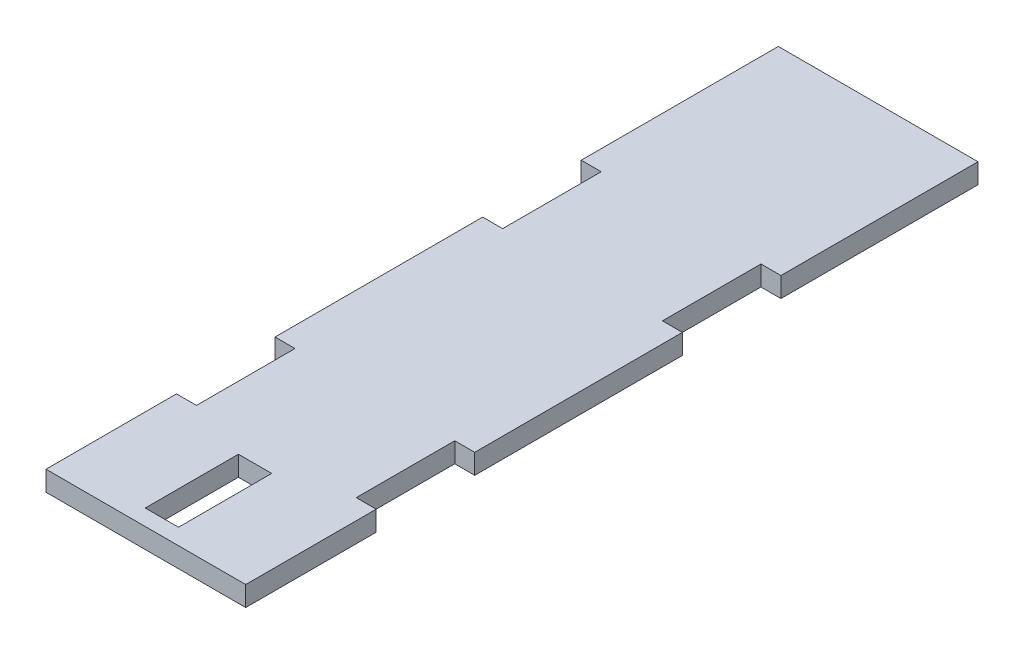
from build123d import *

# Parameters (mm, degrees)
EXTRUDE_1_DEPTH     = 3
SKETCH_2_W          = 30
SKETCH_2_H          = 3
EXTRUDE_2_DEPTH     = 10
SKETCH_4_W          = 5
SKETCH_4_H          = 14
CUT_EXTRUDE_1_DEPTH = 10


with BuildPart() as part:
    # Эскиз1 → Бобышка-Вытянуть1 (new body)
    with BuildSketch(Plane(origin=(0, 0, 0), x_dir=(1, 0, 0), z_dir=(0, 1, 0))):
        Polygon((-15, -50), (15, -50), (15, -30.397249725), (12, -30.397249725), (12, -15.597249725), (15, -15.597249725), (15, 15.597249725), (12, 15.597249725), (12, 30.397249725), (15, 30.397249725), (15, 50), (-15, 50), (-15, 30.397249725), (-12, 30.397249725), (-12, 15.597249725), (-15, 15.597249725), (-15, -15.597249725), (-12, -15.597249725), (-12, -30.397249725), (-15, -30.397249725), align=None)
    extrude(amount=EXTRUDE_1_DEPTH)

    # Эскиз2 → Бобышка-Вытянуть2 (add)
    with BuildSketch(Plane(origin=(0, 0, -50), x_dir=(-1, 0, 0), z_dir=(0, 0, -1))):
        with Locations((0, 1.5)):
            Rectangle(SKETCH_2_W, SKETCH_2_H)
    extrude(amount=EXTRUDE_2_DEPTH)

    # Эскиз4 → Вырез-Вытянуть1 (cut)
    with BuildSketch(Plane(origin=(0, 3, 0), x_dir=(1, 0, 0), z_dir=(0, 1, 0))):
        with Locations((0, -40.597249725)):
            Rectangle(SKETCH_4_W, SKETCH_4_H)
    extrude(amount=-CUT_EXTRUDE_1_DEPTH, mode=Mode.SUBTRACT)


solid = part.part
